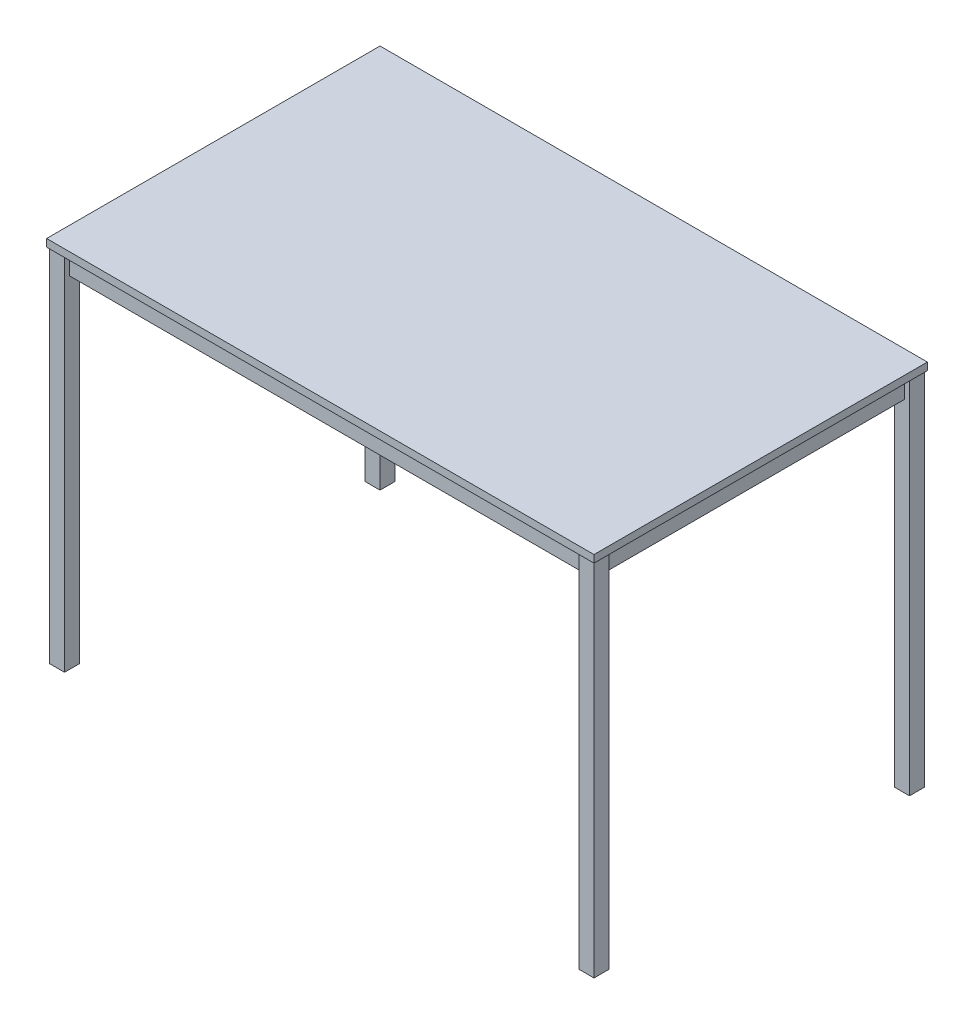
from build123d import *

# Parameters (mm, degrees)
SKETCH1_W               = 1100
SKETCH1_H               = 670
BOSS_EXTRUDE1_DEPTH     = 15
SKETCH2_W               = 30
SKETCH2_H               = 30
BOSS_EXTRUDE2_DEPTH     = 725
MIRROR2_COPY_1_SKETCH_W = 30
MIRROR2_COPY_1_SKETCH_H = 30
MIRROR2_COPY_1_DEPTH    = 725
BOSS_EXTRUDE3_REACH     = 1112.808
SKETCH3_W               = 20
SKETCH3_H               = 40
BOSS_EXTRUDE4_REACH     = 1334.794
SKETCH4_W               = 20
SKETCH4_H               = 40


with BuildPart() as part:
    # Sketch1 → Boss-Extrude1 (new body)
    with BuildSketch(Plane(origin=(0, 0, 0), x_dir=(1, 0, 0), z_dir=(0, 1, 0))):
        Rectangle(SKETCH1_W, SKETCH1_H)
    extrude(amount=BOSS_EXTRUDE1_DEPTH)

    # Sketch2 → Boss-Extrude2 (add)
    with BuildSketch(Plane(origin=(0, 0, 0), x_dir=(1, 0, 0), z_dir=(0, 1, 0))):
        with Locations((-532, -317)):
            Rectangle(SKETCH2_W, SKETCH2_H)
    boss_extrude2 = extrude(amount=-BOSS_EXTRUDE2_DEPTH)

    # Mirror1: Boss-Extrude2 across plane
    add(boss_extrude2.mirror(Plane.XY))

    # Mirror2: Boss-Extrude2 across plane
    add(boss_extrude2.mirror(Plane(origin=(0, 0, 0), x_dir=(0, 0, 1), z_dir=(1, 0, 0))))

    # Mirror2 copy 1 sketch → Mirror2 copy 1 (add)
    with BuildSketch(Plane(origin=(0, 0, 0), x_dir=(-1, 0, 0), z_dir=(0, 1, 0))):
        with Locations((-532, -317)):
            Rectangle(MIRROR2_COPY_1_SKETCH_W, MIRROR2_COPY_1_SKETCH_H)
    extrude(amount=-MIRROR2_COPY_1_DEPTH)

    # Sketch3 → Boss-Extrude3 (add, up to next)
    with BuildSketch(Plane.XY.offset(-302), mode=Mode.PRIVATE) as boss_extrude3_sk1:
        with Locations((-527, -20)):
            Rectangle(SKETCH3_W, SKETCH3_H)
    boss_extrude3_tool1 = extrude(boss_extrude3_sk1.sketch, amount=BOSS_EXTRUDE3_REACH, mode=Mode.PRIVATE) - part.part
    boss_extrude3 = boss_extrude3_tool1.solids().sort_by_distance((-527, -20, -302))[0]
    add(boss_extrude3)

    # Mirror3: Boss-Extrude3 across plane
    add(boss_extrude3.mirror(Plane(origin=(0, 0, 0), x_dir=(0, 0, 1), z_dir=(1, 0, 0))))

    # Sketch4 → Boss-Extrude4 (add, up to next)
    with BuildSketch(Plane(origin=(-517, 0, 0), x_dir=(0, 0, -1), z_dir=(1, 0, 0)), mode=Mode.PRIVATE) as boss_extrude4_sk1:
        with Locations((-312, -20)):
            Rectangle(SKETCH4_W, SKETCH4_H)
    boss_extrude4_tool1 = extrude(boss_extrude4_sk1.sketch, amount=BOSS_EXTRUDE4_REACH, mode=Mode.PRIVATE) - part.part
    boss_extrude4 = boss_extrude4_tool1.solids().sort_by_distance((-517, -20, 312))[0]
    add(boss_extrude4)

    # Mirror4: Boss-Extrude4 across plane
    add(boss_extrude4.mirror(Plane.XY))


solid = part.part
